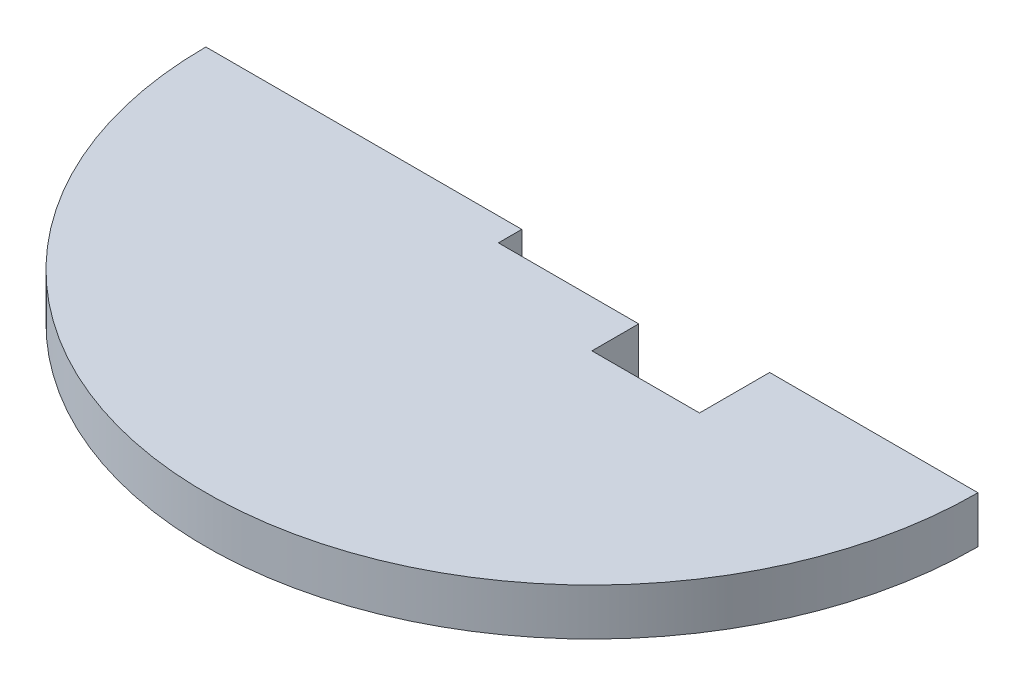
from build123d import *

# Parameters (mm, degrees)
SKETCH1_R           = 82.55
BOSS_EXTRUDE1_DEPTH = 10
SKETCH2_W           = 30
SKETCH2_H           = 10
CUT_EXTRUDE1_DEPTH  = 13
CUT_EXTRUDE2_START  = -10
CUT_EXTRUDE2_DEPTH  = 10
SKETCH5_W           = 23
SKETCH5_H           = 30
CUT_EXTRUDE4_DEPTH  = 10


with BuildPart() as part:
    # Sketch1 → Boss-Extrude1 (new body)
    with BuildSketch(Plane(origin=(0, 0, 0), x_dir=(1, 0, 0), z_dir=(0, 1, 0))):
        with Locations(Location((0, 0, 0), (0, 0, 270))):
            Circle(SKETCH1_R)
    extrude(amount=BOSS_EXTRUDE1_DEPTH)

    # Sketch2 → Cut-Extrude1 (cut)
    with BuildSketch(Plane(origin=(0, 13, 0), x_dir=(1, 0, 0), z_dir=(0, 1, 0))):
        Rectangle(SKETCH2_W, SKETCH2_H)
    extrude(amount=-CUT_EXTRUDE1_DEPTH, mode=Mode.SUBTRACT)

    # Sketch3 → Cut-Extrude2 (cut)
    with BuildSketch(Plane(origin=(0, 10, 0), x_dir=(1, 0, 0), z_dir=(0, 1, 0)).offset(CUT_EXTRUDE2_START)):
        with BuildLine():
            ThreePointArc((82.55, 0), (0, 82.55), (-82.55, 0))
            Line((-82.55, 0), (-15, 0))
            Line((-15, 0), (-15, 5))
            Line((-15, 5), (15, 5))
            Line((15, 5), (15, 0))
            Line((15, 0), (82.55, 0))
        make_face()
    extrude(amount=CUT_EXTRUDE2_DEPTH, mode=Mode.SUBTRACT)

    # Sketch5 → Cut-Extrude4 (cut)
    with BuildSketch(Plane(origin=(0, 10, 0), x_dir=(1, 0, 0), z_dir=(0, 1, 0))):
        with Locations((26.5, 0)):
            Rectangle(SKETCH5_W, SKETCH5_H)
    extrude(amount=-CUT_EXTRUDE4_DEPTH, mode=Mode.SUBTRACT)


solid = part.part
